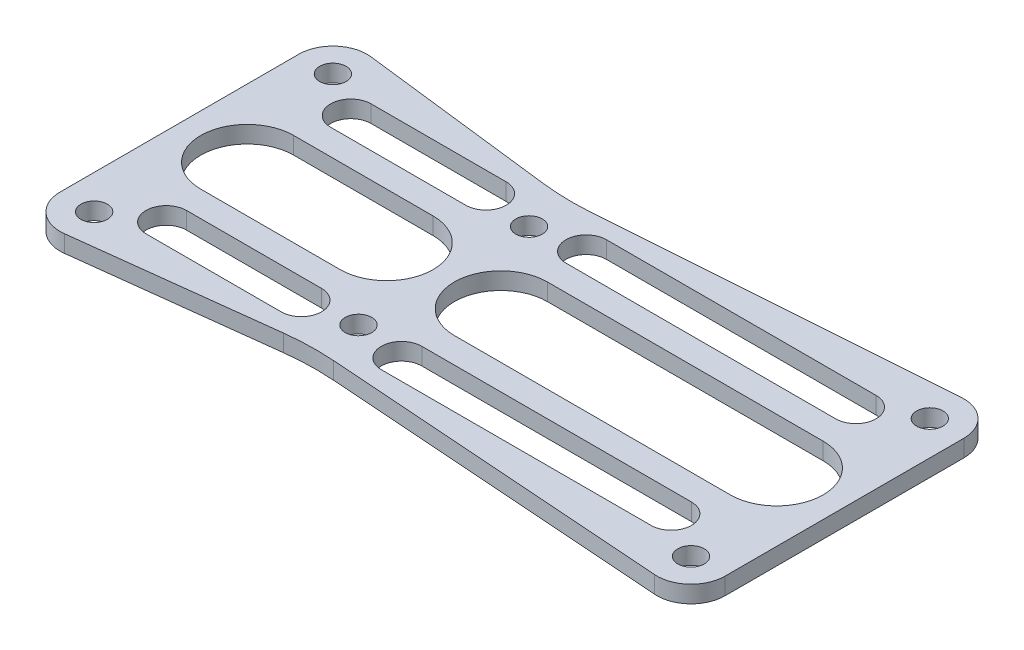
from build123d import *

# Parameters (mm, degrees)
EXTRUDE_1_DEPTH          = 2
HOLE_WIZARD_1_D          = 3.1
CUT_EXTRUDE_1_DEPTH      = 44
CUT_EXTRUDE_1_DEPTH_BACK = 44
SKETCH_5_W               = 102.055692614
SKETCH_5_H               = 55.211945292
CUT_EXTRUDE_2_DEPTH      = 44
CUT_EXTRUDE_2_DEPTH_BACK = 44


with BuildPart() as part:
    # 草图1 → 凸台-拉伸1 (new body)
    with BuildSketch(Plane(origin=(0, 0, 0), x_dir=(1, 0, 0), z_dir=(0, 1, 0))):
        with BuildLine():
            Line((35, 18), (-35, 18))
            ThreePointArc((-35, 18), (-37.828427125, 16.828427125), (-39, 14))
            Line((-39, 14), (-39, -14))
            ThreePointArc((-39, -14), (-37.828427125, -16.828427125), (-35, -18))
            Line((-35, -18), (35, -18))
            ThreePointArc((35, -18), (37.828427125, -16.828427125), (39, -14))
            Line((39, -14), (39, 14))
            ThreePointArc((39, 14), (37.828427125, 16.828427125), (35, 18))
        make_face()
    extrude(amount=EXTRUDE_1_DEPTH)

    # 孔1 (through all)
    with Locations(Plane(origin=(0, 2, 0), x_dir=(1, 0, 0), z_dir=(0, 1, 0))):
        with Locations((-8, 10), (-8, -10), (-35, -14), (-35, 14), (35, 14), (35, -14)):
            Hole(HOLE_WIZARD_1_D / 2)

    # 草图5 → 切除-拉伸1 (cut, two sides: drawn at the far end of the back side and taken through both)
    with BuildSketch(Plane(origin=(0, 2, 0), x_dir=(1, 0, 0), z_dir=(0, 1, 0)).offset(-CUT_EXTRUDE_1_DEPTH_BACK)):
        Rectangle(SKETCH_5_W, SKETCH_5_H)
        with BuildLine():
            Line((-11.560116303, 15.213061974), (-34.522933375, 17.971449035))
            ThreePointArc((-34.522933375, 17.971449035), (-37.65440516, 16.992345777), (-39, 14))
            Line((-39, 14), (-39, -14))
            ThreePointArc((-39, -14), (-37.65440516, -16.992345777), (-34.522933375, -17.971449035))
            Line((-34.522933375, -17.971449035), (-11.560116303, -15.213061974))
            ThreePointArc((-11.560116303, -15.213061974), (-8.714551025, -15.008553692), (-5.862458688, -15.076632276))
            Line((-5.862458688, -15.076632276), (34.713562836, -17.989731037))
            ThreePointArc((34.713562836, -17.989731037), (37.725275339, -16.927947118), (39, -14))
            Line((39, -14), (39, 14))
            ThreePointArc((39, 14), (37.725275339, 16.927947118), (34.713562836, 17.989731037))
            Line((34.713562836, 17.989731037), (-5.862458688, 15.076632276))
            ThreePointArc((-5.862458688, 15.076632276), (-8.714551025, 15.008553692), (-11.560116303, 15.213061974))
        make_face(mode=Mode.SUBTRACT)
    extrude(amount=CUT_EXTRUDE_1_DEPTH + CUT_EXTRUDE_1_DEPTH_BACK, mode=Mode.SUBTRACT)

    # 草图6 → 切除-拉伸2 (cut, two sides: drawn at the far end of the back side and taken through both)
    with BuildSketch(Plane(origin=(0, 2, 0), x_dir=(1, 0, 0), z_dir=(0, 1, 0)).offset(-CUT_EXTRUDE_2_DEPTH_BACK)):
        with BuildLine():
            Line((-2.125, 13.2), (29.5058803, 13.2))
            ThreePointArc((29.5058803, 13.2), (31.8808803, 10.825), (29.5058803, 8.45))
            Line((29.5058803, 8.45), (-2.125, 8.45))
            ThreePointArc((-2.125, 8.45), (-4.5, 10.825), (-2.125, 13.2))
        make_face()
        with BuildLine():
            Line((-13.875, 8.45), (-29.719593784, 8.45))
            ThreePointArc((-29.719593784, 8.45), (-32.094593784, 10.825), (-29.719593784, 13.2))
            Line((-29.719593784, 13.2), (-13.875, 13.2))
            ThreePointArc((-13.875, 13.2), (-11.5, 10.825), (-13.875, 8.45))
        make_face()
        with BuildLine():
            Line((-2.125, -13.2), (29.5058803, -13.2))
            ThreePointArc((29.5058803, -13.2), (31.8808803, -10.825), (29.5058803, -8.45))
            Line((29.5058803, -8.45), (-2.125, -8.45))
            ThreePointArc((-2.125, -8.45), (-4.5, -10.825), (-2.125, -13.2))
        make_face()
        with BuildLine():
            Line((-13.875, -8.45), (-29.719593784, -8.45))
            ThreePointArc((-29.719593784, -8.45), (-32.094593784, -10.825), (-29.719593784, -13.2))
            Line((-29.719593784, -13.2), (-13.875, -13.2))
            ThreePointArc((-13.875, -13.2), (-11.5, -10.825), (-13.875, -8.45))
        make_face()
        with BuildLine():
            Line((-31.05, 5.45), (-14.7, 5.45))
            ThreePointArc((-14.7, 5.45), (-9.25, 0), (-14.7, -5.45))
            Line((-14.7, -5.45), (-31.05, -5.45))
            ThreePointArc((-31.05, -5.45), (-36.5, 0), (-31.05, 5.45))
        make_face()
        with BuildLine():
            Line((-1.3, 5.45), (31.05, 5.45))
            ThreePointArc((31.05, 5.45), (36.5, 0), (31.05, -5.45))
            Line((31.05, -5.45), (-1.3, -5.45))
            ThreePointArc((-1.3, -5.45), (-6.75, 0), (-1.3, 5.45))
        make_face()
    extrude(amount=CUT_EXTRUDE_2_DEPTH + CUT_EXTRUDE_2_DEPTH_BACK, mode=Mode.SUBTRACT)


solid = part.part
